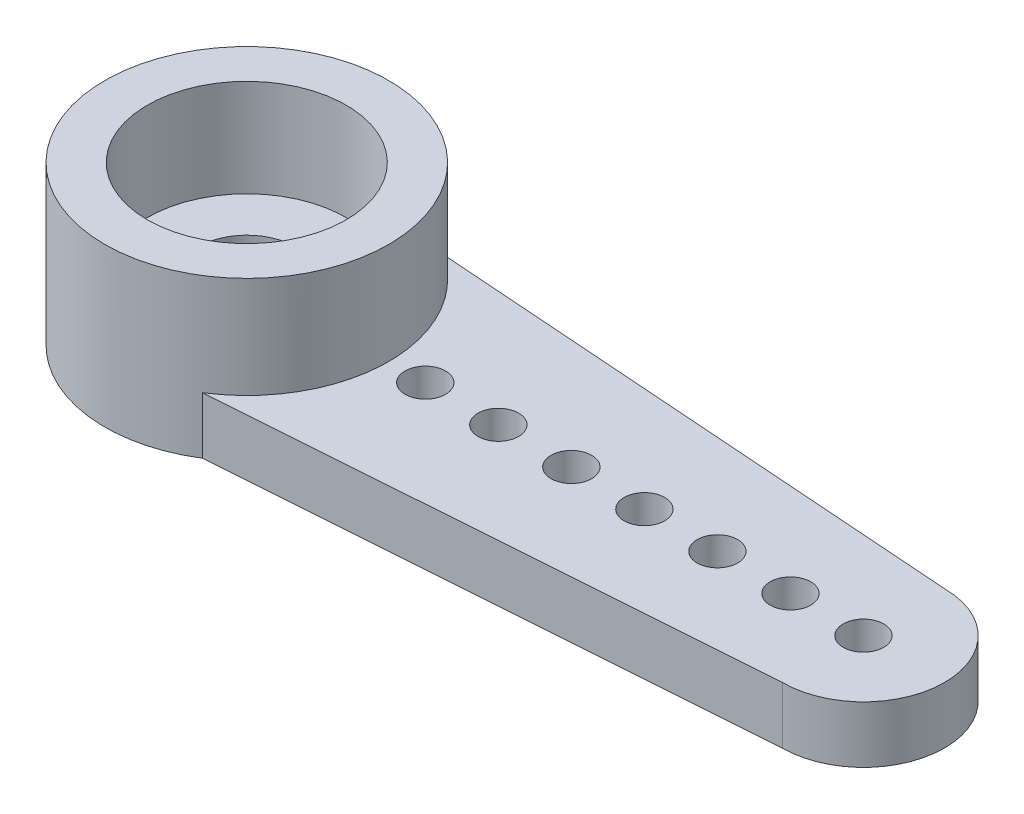
from build123d import *

# Parameters (mm, degrees)
SKETCH1_R           = 0.5
BOSS_EXTRUDE1_DEPTH = 1.4
SKETCH2_R           = 2.35
CUT_EXTRUDE1_DEPTH  = 1
SKETCH3_R           = 3.5
SKETCH3_R_2         = 2.45
BOSS_EXTRUDE2_DEPTH = 2.5
SKETCH4_R           = 1.2
CUT_EXTRUDE2_DEPTH  = 20.282440198
SKETCH5_R           = 2.45
SKETCH5_R_2         = 1.2
BOSS_EXTRUDE3_DEPTH = 0.1
SKETCH6_W           = 35.735260114
SKETCH6_H           = 17.672039004
CUT_EXTRUDE4_DEPTH  = 20.513392837
CUT_EXTRUDE5_DEPTH  = 18.980545042


with BuildPart() as part:
    # Sketch1 → Boss-Extrude1 (new body)
    with BuildSketch(Plane(origin=(0, 0, 0), x_dir=(1, 0, 0), z_dir=(0, 1, 0))):
        with BuildLine():
            Line((-15.2, 2), (-2, 2.95))
            Line((-2, 2.95), (-2, 6.35))
            ThreePointArc((-2, 6.35), (0, 8.35), (2, 6.35))
            Line((2, 6.35), (2, 3.5))
            Line((2, 3.5), (15.2, 2))
            ThreePointArc((15.2, 2), (17.2, 0), (15.2, -2))
            Line((15.2, -2), (2, -3.5))
            Line((2, -3.5), (2, -6.35))
            ThreePointArc((2, -6.35), (0, -8.35), (-2, -6.35))
            Line((-2, -6.35), (-2, -2.95))
            Line((-2, -2.95), (-15.2, -2))
            ThreePointArc((-15.2, -2), (-17.2, 0), (-15.2, 2))
        make_face()
        with Locations(Location((0, 6.35, 0), (0, 0, 270))):
            Circle(SKETCH1_R, mode=Mode.SUBTRACT)
        with Locations(Location((0, 4.55, 0), (0, 0, 270))):
            Circle(SKETCH1_R, mode=Mode.SUBTRACT)
        with Locations(Location((0, -4.55, 0), (0, 0, 90))):
            Circle(SKETCH1_R, mode=Mode.SUBTRACT)
        with Locations(Location((0, -6.35, 0), (0, 0, 90))):
            Circle(SKETCH1_R, mode=Mode.SUBTRACT)
        with Locations(Location((-15.2, 0, 0), (0, 0, 270))):
            Circle(SKETCH1_R, mode=Mode.SUBTRACT)
        with Locations(Location((15.2, 0, 0), (0, 0, 270))):
            Circle(SKETCH1_R, mode=Mode.SUBTRACT)
        with Locations(Location((-13.4, 0, 0), (0, 0, 270))):
            Circle(SKETCH1_R, mode=Mode.SUBTRACT)
        with Locations(Location((-11.6, 0, 0), (0, 0, 270))):
            Circle(SKETCH1_R, mode=Mode.SUBTRACT)
        with Locations(Location((-9.8, 0, 0), (0, 0, 270))):
            Circle(SKETCH1_R, mode=Mode.SUBTRACT)
        with Locations(Location((-8, 0, 0), (0, 0, 270))):
            Circle(SKETCH1_R, mode=Mode.SUBTRACT)
        with Locations(Location((-6.2, 0, 0), (0, 0, 270))):
            Circle(SKETCH1_R, mode=Mode.SUBTRACT)
        with Locations(Location((-4.4, 0, 0), (0, 0, 270))):
            Circle(SKETCH1_R, mode=Mode.SUBTRACT)
        with Locations(Location((13.4, 0, 0), (0, 0, 270))):
            Circle(SKETCH1_R, mode=Mode.SUBTRACT)
        with Locations(Location((11.6, 0, 0), (0, 0, 270))):
            Circle(SKETCH1_R, mode=Mode.SUBTRACT)
        with Locations(Location((9.8, 0, 0), (0, 0, 270))):
            Circle(SKETCH1_R, mode=Mode.SUBTRACT)
        with Locations(Location((8, 0, 0), (0, 0, 270))):
            Circle(SKETCH1_R, mode=Mode.SUBTRACT)
        with Locations(Location((6.2, 0, 0), (0, 0, 270))):
            Circle(SKETCH1_R, mode=Mode.SUBTRACT)
        with Locations(Location((4.4, 0, 0), (0, 0, 270))):
            Circle(SKETCH1_R, mode=Mode.SUBTRACT)
    extrude(amount=BOSS_EXTRUDE1_DEPTH)

    # Sketch2 → Cut-Extrude1 (cut)
    with BuildSketch(Plane.XZ):
        with Locations(Location((0, 0, 0), (0, 0, 270))):
            Circle(SKETCH2_R)
    extrude(amount=-CUT_EXTRUDE1_DEPTH, mode=Mode.SUBTRACT)

    # Sketch3 → Boss-Extrude2 (add)
    with BuildSketch(Plane(origin=(0, 1.4, 0), x_dir=(1, 0, 0), z_dir=(0, 1, 0))):
        with Locations(Location((0, 0, 0), (0, 0, 270))):
            Circle(SKETCH3_R)
        with Locations(Location((0, 0, 0), (0, 0, 270))):
            Circle(SKETCH3_R_2, mode=Mode.SUBTRACT)
    extrude(amount=BOSS_EXTRUDE2_DEPTH)

    # Sketch4 → Cut-Extrude2 (cut, through all)
    with BuildSketch(Plane(origin=(0, 1.4, 0), x_dir=(1, 0, 0), z_dir=(0, 1, 0))):
        with Locations(Location((0, 0, 0), (0, 0, 270))):
            Circle(SKETCH4_R)
    extrude(amount=-CUT_EXTRUDE2_DEPTH, mode=Mode.SUBTRACT)

    # Sketch5 → Boss-Extrude3 (add)
    with BuildSketch(Plane(origin=(0, 1.4, 0), x_dir=(1, 0, 0), z_dir=(0, 1, 0))):
        with Locations(Location((0, 0, 0), (0, 0, 270))):
            Circle(SKETCH5_R)
        with Locations(Location((0, 0, 0), (0, 0, 270))):
            Circle(SKETCH5_R_2, mode=Mode.SUBTRACT)
    extrude(amount=BOSS_EXTRUDE3_DEPTH)

    # Sketch6 → Cut-Extrude4 (cut, through all)
    with BuildSketch(Plane.XZ):
        Rectangle(SKETCH6_W, SKETCH6_H)
        with BuildLine():
            Line((-1.868584713, -2.959457918), (-15.2, -2))
            ThreePointArc((-15.2, -2), (-17.2, 0), (-15.2, 2))
            Line((-15.2, 2), (-1.868584713, 2.959457918))
            ThreePointArc((-1.868584713, 2.959457918), (0, 3.5), (1.868584713, 2.959457918))
            Line((1.868584713, 2.959457918), (15.2, 2))
            ThreePointArc((15.2, 2), (17.2, 0), (15.2, -2))
            Line((15.2, -2), (1.868584713, -2.959457918))
            ThreePointArc((1.868584713, -2.959457918), (0, -3.5), (-1.868584713, -2.959457918))
        make_face(mode=Mode.SUBTRACT)
    extrude(amount=-CUT_EXTRUDE4_DEPTH, mode=Mode.SUBTRACT)

    # Sketch7 → Cut-Extrude5 (cut, through all)
    with BuildSketch(Plane.XZ):
        with BuildLine():
            Line((0, 3.5), (-17.731768104, 3.5))
            Line((-17.731768104, 3.5), (-17.731768104, -3.5))
            Line((-17.731768104, -3.5), (0, -3.5))
            ThreePointArc((0, -3.5), (-3.5, 0), (0, 3.5))
        make_face()
    extrude(amount=-CUT_EXTRUDE5_DEPTH, mode=Mode.SUBTRACT)


solid = part.part
